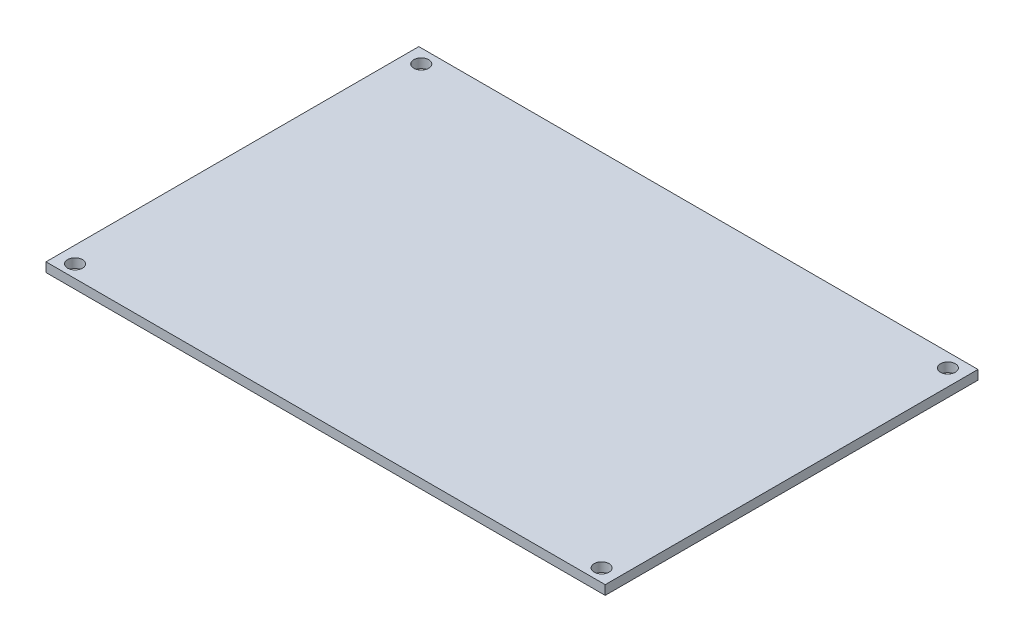
from build123d import *

# Parameters (mm, degrees)
SKETCH_1_W          = 120
SKETCH_1_H          = 80
EXTRUDE_1_DEPTH     = 2
SKETCH_2_R          = 1.6
CUT_EXTRUDE_1_DEPTH = 10


with BuildPart() as part:
    # 草图1 → 凸台-拉伸1 (new body)
    with BuildSketch(Plane(origin=(0, 0, 0), x_dir=(1, 0, 0), z_dir=(0, 1, 0))):
        with Locations((-24.884178173, 42.281040329)):
            Rectangle(SKETCH_1_W, SKETCH_1_H)
    extrude(amount=EXTRUDE_1_DEPTH)

    # 草图2 → 切除-拉伸1 (cut)
    with BuildSketch(Plane(origin=(0, 2, 0), x_dir=(1, 0, 0), z_dir=(0, 1, 0))):
        with Locations(Location((-81.387195753, 79.313462432, 0), (0, 0, 270))):
            Circle(SKETCH_2_R)
        with Locations(Location((-81.387195753, 5.013462432, 0), (0, 0, 270))):
            Circle(SKETCH_2_R)
        with Locations(Location((31.612804247, 5.013462432, 0), (0, 0, 270))):
            Circle(SKETCH_2_R)
        with Locations(Location((31.612804247, 79.313462432, 0), (0, 0, 270))):
            Circle(SKETCH_2_R)
    extrude(amount=-CUT_EXTRUDE_1_DEPTH, mode=Mode.SUBTRACT)


solid = part.part
